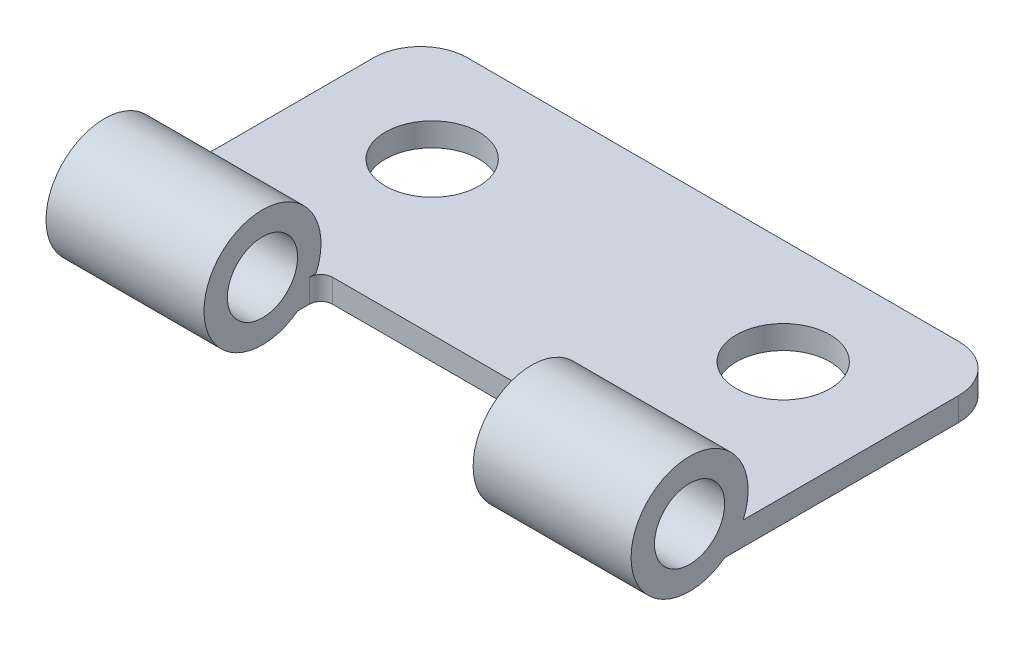
from build123d import *

# Parameters (mm, degrees)
SKETCH_1_R      = 2
EXTRUDE_1_DEPTH = 1
FILLET_1_R      = 2
FILLET_2_R      = 0.5
EXTRUDE_START   = -5.75
SKETCH_2_R      = 2.5
SKETCH_2_R_2    = 1.5
EXTRUDE_2_DEPTH = 6.75
EXTRUDE_START_2 = 12.5
SKETCH_2_3_R    = 2.5
SKETCH_2_3_R_2  = 1.5
EXTRUDE_3_DEPTH = 6.75


with BuildPart() as part:
    # 草图1 → 凸台-拉伸1 (new body)
    with BuildSketch(Plane(origin=(0, 0, 0), x_dir=(1, 0, 0), z_dir=(0, 1, 0))):
        Polygon((-5.75, 0), (-5.75, 1), (5.75, 1), (5.75, 0), (12.5, 0), (12.5, 1), (12.5, 12), (-12.5, 12), (-12.5, 1), (-12.5, 0), align=None)
        with Locations(Location((-7.5, 7.5, 0), (0, 0, 270))):
            Circle(SKETCH_1_R, mode=Mode.SUBTRACT)
        with Locations(Location((7.5, 7.5, 0), (0, 0, 270))):
            Circle(SKETCH_1_R, mode=Mode.SUBTRACT)
    extrude(amount=EXTRUDE_1_DEPTH)

    # 圆角1
    fillet_1_edges = [part.edges().sort_by_distance(p)[0] for p in [
        (-12.5, 0.5, -12),
        (12.5, 0.5, -12),
    ]]
    fillet(fillet_1_edges, radius=FILLET_1_R)

    # 圆角2
    fillet_2_edges = [part.edges().sort_by_distance(p)[0] for p in [
        (5.75, 0.5, -1),
        (-5.75, 0.5, -1),
    ]]
    fillet(fillet_2_edges, radius=FILLET_2_R)

    # 草图2 → 凸台-拉伸2 (add)
    with BuildSketch(Plane(origin=(0, 0, 0), x_dir=(0, 0, -1), z_dir=(1, 0, 0)).offset(EXTRUDE_START)):
        with Locations((-1.5, 2)):
            Circle(SKETCH_2_R)
        with Locations((-1.5, 2)):
            Circle(SKETCH_2_R_2, mode=Mode.SUBTRACT)
    extrude(amount=-EXTRUDE_2_DEPTH)

    # 草图2<3> → 凸台-拉伸3 (add)
    with BuildSketch(Plane(origin=(0, 0, 0), x_dir=(0, 0, -1), z_dir=(1, 0, 0)).offset(EXTRUDE_START_2)):
        with Locations((-1.5, 2)):
            Circle(SKETCH_2_3_R)
        with Locations((-1.5, 2)):
            Circle(SKETCH_2_3_R_2, mode=Mode.SUBTRACT)
    extrude(amount=-EXTRUDE_3_DEPTH)


solid = part.part
